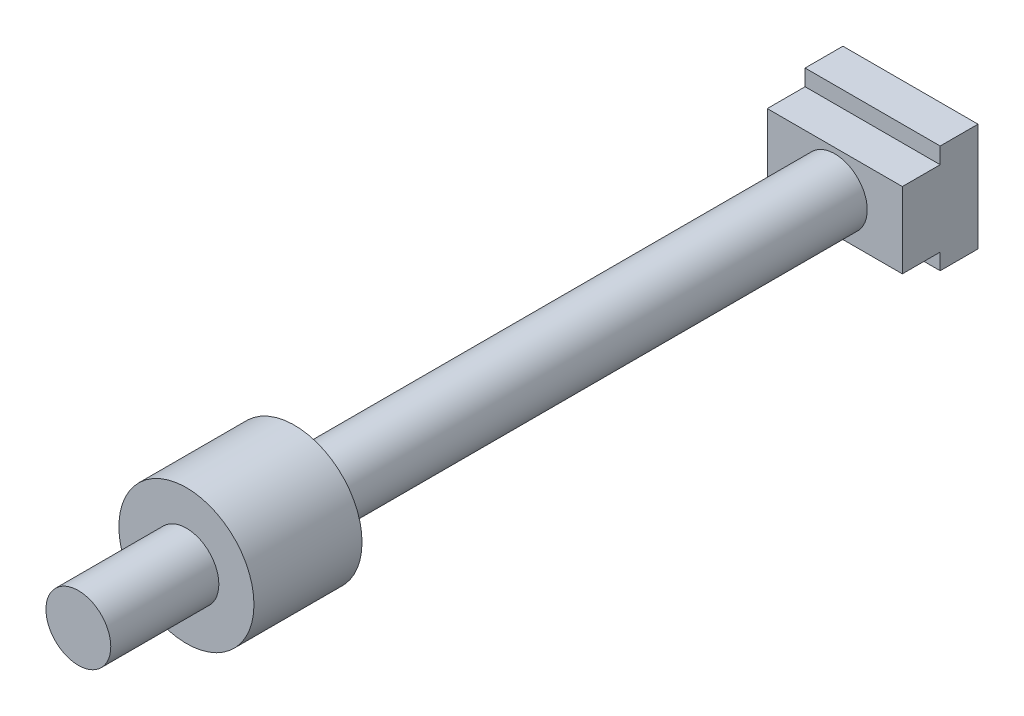
from build123d import *

# Parameters (mm, degrees)
SKETCH1_R           = 6
BOSS_EXTRUDE1_DEPTH = 100
SKETCH2_R           = 12.5
BOSS_EXTRUDE2_DEPTH = 20
SKETCH3_R           = 6
BOSS_EXTRUDE3_DEPTH = 20
SKETCH4_W           = 25
SKETCH4_H           = 14
BOSS_EXTRUDE4_DEPTH = 7
SKETCH5_W           = 25
SKETCH5_H           = 20
BOSS_EXTRUDE5_DEPTH = 7


with BuildPart() as part:
    # Sketch1 → Boss-Extrude1 (new body)
    with BuildSketch(Plane.XY):
        Circle(SKETCH1_R)
    extrude(amount=BOSS_EXTRUDE1_DEPTH)

    # Sketch2 → Boss-Extrude2 (add)
    with BuildSketch(Plane.XY.offset(100)):
        Circle(SKETCH2_R)
    extrude(amount=BOSS_EXTRUDE2_DEPTH)

    # Sketch3 → Boss-Extrude3 (add)
    with BuildSketch(Plane.XY.offset(120)):
        Circle(SKETCH3_R)
    extrude(amount=BOSS_EXTRUDE3_DEPTH)

    # Sketch4 → Boss-Extrude4 (add)
    with BuildSketch(Plane(origin=(0, 0, 0), x_dir=(-1, 0, 0), z_dir=(0, 0, -1))):
        Rectangle(SKETCH4_W, SKETCH4_H)
    extrude(amount=BOSS_EXTRUDE4_DEPTH)

    # Sketch5 → Boss-Extrude5 (add)
    with BuildSketch(Plane(origin=(0, 0, -7), x_dir=(-1, 0, 0), z_dir=(0, 0, -1))):
        Rectangle(SKETCH5_W, SKETCH5_H)
    extrude(amount=BOSS_EXTRUDE5_DEPTH)


solid = part.part
